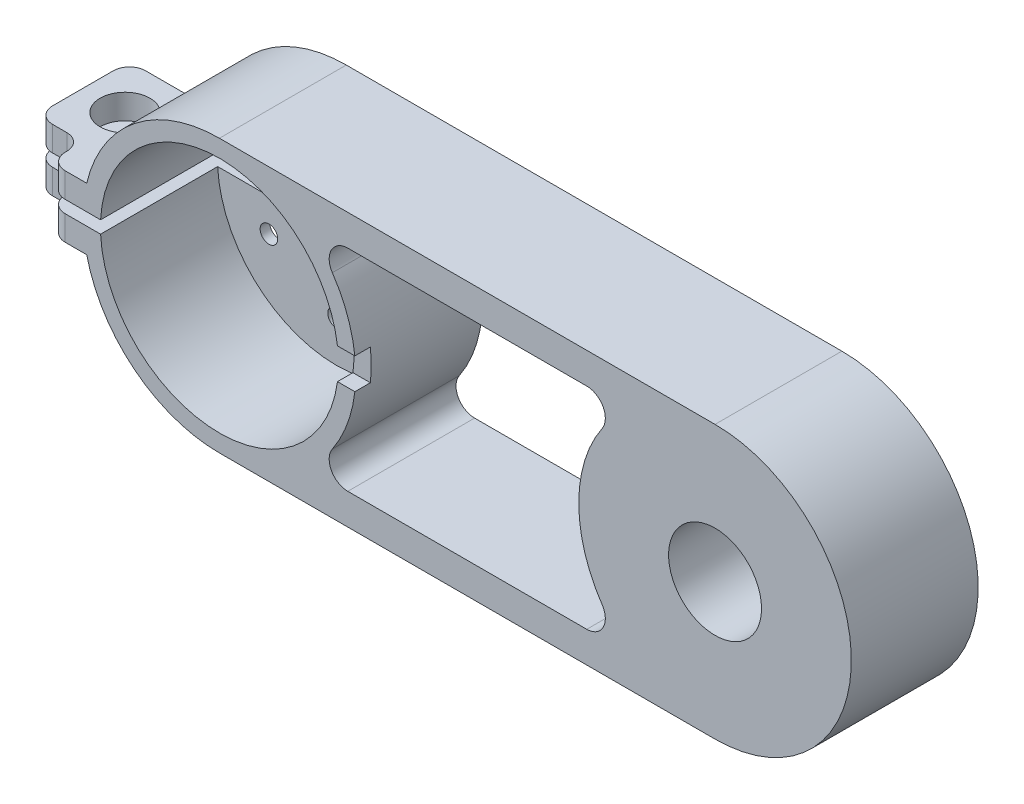
from build123d import *

# Parameters (mm, degrees)
BOSS_EXTRUDE1_DEPTH          = 13
M1_6_CLEARANCE_HOLE2_D       = 1.8
F_3_8_0_375_DIAMETER_HOLE1_D = 9.525
CUT_EXTRUDE1_START           = 1
SKETCH1_4_R                  = 12.2
CUT_EXTRUDE1_DEPTH           = 43.751089129
BOSS_EXTRUDE2_DEPTH          = 3.175
F_10_CLEARANCE_HOLE1_D       = 5.1054
FILLET1_R                    = 1.651
CUT_EXTRUDE2_DEPTH           = 52.305959936
CUT_EXTRUDE3_DEPTH           = 52.305959936
FILLET2_R                    = 1.905
CUT_EXTRUDE4_DEPTH           = 1.5875


with BuildPart() as part:
    # Sketch1 → Boss-Extrude1 (new body)
    with BuildSketch(Plane.XY):
        with BuildLine():
            Line((-25.4, -13.97), (25.4, -13.97))
            ThreePointArc((25.4, -13.97), (39.37, 0), (25.4, 13.97))
            Line((25.4, 13.97), (-25.4, 13.97))
            ThreePointArc((-25.4, 13.97), (-39.37, 0), (-25.4, -13.97))
        make_face()
    extrude(amount=BOSS_EXTRUDE1_DEPTH)

    # M1.6 Clearance Hole2 (through all)
    with Locations(Plane.XY.offset(13)):
        with Locations((-32.32820323, 4), (-25.4, 8), (-18.47179677, 4), (-18.47179677, -4), (-25.4, -8), (-32.32820323, -4)):
            Hole(M1_6_CLEARANCE_HOLE2_D / 2)

    # 3/8 (0.375) Diameter Hole1 (through all)
    with Locations(Plane.XY.offset(13)):
        with Locations((25.4, 0)):
            Hole(F_3_8_0_375_DIAMETER_HOLE1_D / 2)

    # Sketch1<4> → Cut-Extrude1 (cut, through all)
    with BuildSketch(Plane.XY.offset(CUT_EXTRUDE1_START)):
        with Locations((-25.4, 0)):
            Circle(SKETCH1_4_R)
    extrude(amount=CUT_EXTRUDE1_DEPTH, mode=Mode.SUBTRACT)

    # Sketch7 → Boss-Extrude2 (add, symmetric)
    with BuildSketch(Plane(origin=(0, 0, 0), x_dir=(1, 0, 0), z_dir=(0, 1, 0))):
        Polygon((-38.1, 0), (-47.625, 0), (-47.625, -9.525), (-42.8625, -9.525), (-42.8625, -13), (-38.1, -13), align=None)
    extrude(amount=BOSS_EXTRUDE2_DEPTH, both=True)

    # #10 Clearance Hole1 (through all)
    with Locations(Plane(origin=(0, -3.175, 0), x_dir=(-1, 0, 0), z_dir=(0, -1, 0))):
        with Locations((43.314710578, -4.7625)):
            Hole(F_10_CLEARANCE_HOLE1_D / 2)

    # Fillet1
    fillet1_edges = [part.edges().sort_by_distance(p)[0] for p in [
        (-47.625, 0, 0),
        (-42.8625, 0, 13),
        (-42.8625, 0, 9.525),
        (-47.625, 0, 9.525),
    ]]
    fillet(fillet1_edges, radius=FILLET1_R)

    # Sketch9 → Cut-Extrude2 (cut, through all)
    with BuildSketch(Plane.XY.offset(13)):
        with BuildLine():
            Line((-47.625, 0.635), (-47.625, -0.635))
            Line((-47.625, -0.635), (-29.095845641, -0.635))
            ThreePointArc((-29.095845641, -0.635), (-21.65, 0), (-29.095845641, 0.635))
            Line((-29.095845641, 0.635), (-47.625, 0.635))
        make_face()
    extrude(amount=-CUT_EXTRUDE2_DEPTH, mode=Mode.SUBTRACT)

    # Sketch13 → Cut-Extrude3 (cut, through all)
    with BuildSketch(Plane.XY.offset(13)):
        with BuildLine():
            Line((-16.532707572, 10.795), (16.532707572, 10.795))
            ThreePointArc((16.532707572, 10.795), (11.43, 0), (16.532707572, -10.795))
            Line((16.532707572, -10.795), (-16.532707572, -10.795))
            ThreePointArc((-16.532707572, -10.795), (-11.43, 0), (-16.532707572, 10.795))
        make_face()
    extrude(amount=-CUT_EXTRUDE3_DEPTH, mode=Mode.SUBTRACT)

    # Fillet2
    fillet2_edges = [part.edges().sort_by_distance(p)[0] for p in [
        (16.532707572, -10.795, 6.5),
        (16.532707572, 10.795, 6.5),
        (-16.532707572, 10.795, 6.5),
        (-16.532707572, -10.795, 6.5),
    ]]
    fillet(fillet2_edges, radius=FILLET2_R)

    # Sketch14 → Cut-Extrude4 (cut)
    with BuildSketch(Plane.XY.offset(13)):
        with BuildLine():
            Line((-25.4, 1.5875), (0, 1.5875))
            ThreePointArc((0, 1.5875), (1.5875, 0), (0, -1.5875))
            Line((0, -1.5875), (-25.4, -1.5875))
            ThreePointArc((-25.4, -1.5875), (-26.9875, 0), (-25.4, 1.5875))
        make_face()
    extrude(amount=-CUT_EXTRUDE4_DEPTH, mode=Mode.SUBTRACT)


solid = part.part
